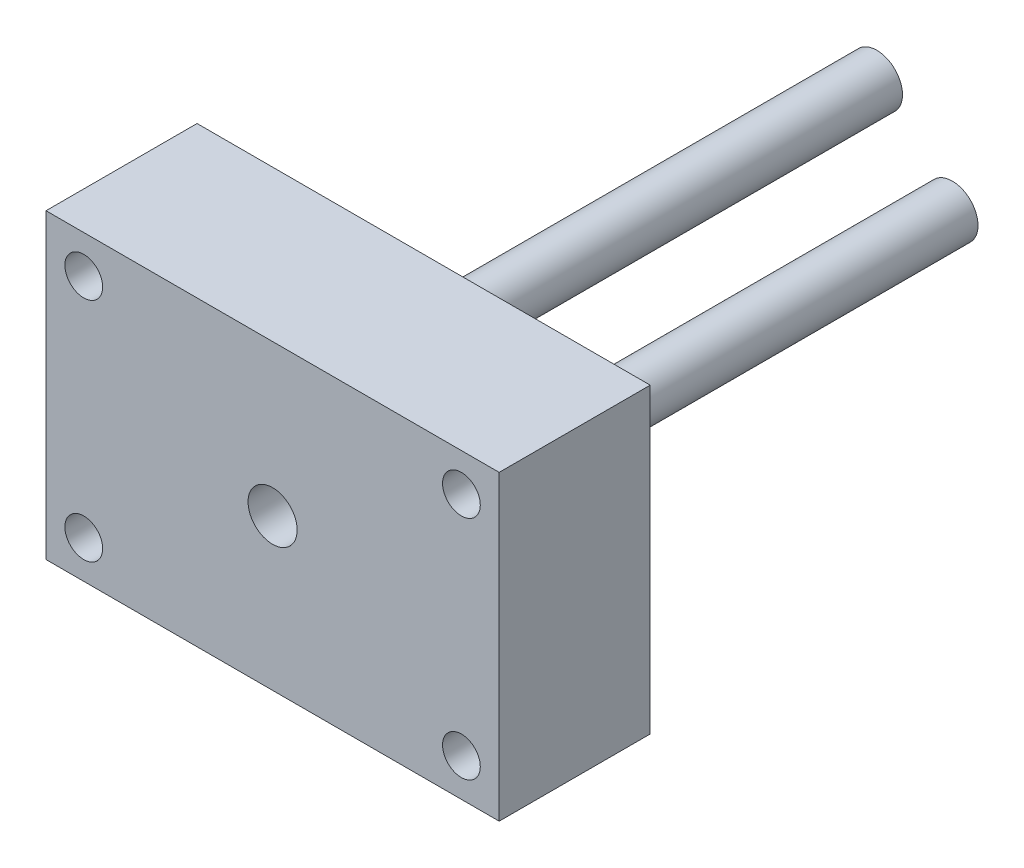
from build123d import *

# Parameters (mm, degrees)
SKETCH1_W           = 76.2
SKETCH1_H           = 50.8
SKETCH1_R           = 4.31365531
BOSS_EXTRUDE2_DEPTH = 25.4
SKETCH6_R           = 4.1275
SKETCH6_R_2         = 3.175
CUT_EXTRUDE3_DEPTH  = 25.4
BOSS_EXTRUDE3_START = -101.6
SKETCH7_R           = 4.31365531
BOSS_EXTRUDE3_DEPTH = 101.6
BOSS_EXTRUDE5_START = -101.6
SKETCH9_R           = 4.31365531
BOSS_EXTRUDE5_DEPTH = 101.6
SKETCH11_R          = 4.316155828
BOSS_EXTRUDE6_DEPTH = 101.6
BOSS_EXTRUDE7_START = -101.6
SKETCH14_R          = 4.31365531
BOSS_EXTRUDE7_DEPTH = 101.6


with BuildPart() as part:
    # Sketch1 → Boss-Extrude2 (new body)
    with BuildSketch(Plane.XY):
        with Locations((38.1, 25.4)):
            Rectangle(SKETCH1_W, SKETCH1_H)
        with Locations((38.1, 38.1)):
            Circle(SKETCH1_R, mode=Mode.SUBTRACT)
        with Locations((50.8, 25.4)):
            Circle(SKETCH1_R, mode=Mode.SUBTRACT)
        with Locations((38.1, 12.7)):
            Circle(SKETCH1_R, mode=Mode.SUBTRACT)
        with Locations((25.4, 25.4)):
            Circle(SKETCH1_R, mode=Mode.SUBTRACT)
    extrude(amount=BOSS_EXTRUDE2_DEPTH)

    # Sketch6 → Cut-Extrude3 (cut)
    with BuildSketch(Plane.XY.offset(25.4)):
        with Locations((38.1, 25.4)):
            Circle(SKETCH6_R)
        with Locations((6.35, 44.45)):
            Circle(SKETCH6_R_2)
        with Locations((69.85, 44.45)):
            Circle(SKETCH6_R_2)
        with Locations((6.35, 6.35)):
            Circle(SKETCH6_R_2)
        with Locations((69.85, 6.35)):
            Circle(SKETCH6_R_2)
    extrude(amount=-CUT_EXTRUDE3_DEPTH, mode=Mode.SUBTRACT)

    # Sketch7 → Boss-Extrude3 (add)
    with BuildSketch(Plane.XY.offset(25.4).offset(BOSS_EXTRUDE3_START)):
        with Locations((25.4, 25.4)):
            Circle(SKETCH7_R)
    extrude(amount=BOSS_EXTRUDE3_DEPTH)

    # Sketch9 → Boss-Extrude5 (add)
    with BuildSketch(Plane.XY.offset(25.4).offset(BOSS_EXTRUDE5_START)):
        with Locations((50.8, 25.4)):
            Circle(SKETCH9_R)
    extrude(amount=BOSS_EXTRUDE5_DEPTH)

    # Sketch11 → Boss-Extrude6 (add)
    with BuildSketch(Plane.XY.offset(25.4)):
        with Locations((38.097842062, 38.101263286)):
            Circle(SKETCH11_R)
    extrude(amount=-BOSS_EXTRUDE6_DEPTH)

    # Sketch14 → Boss-Extrude7 (add)
    with BuildSketch(Plane.XY.offset(25.4).offset(BOSS_EXTRUDE7_START)):
        with Locations((38.1, 12.7)):
            Circle(SKETCH14_R)
    extrude(amount=BOSS_EXTRUDE7_DEPTH)


solid = part.part
